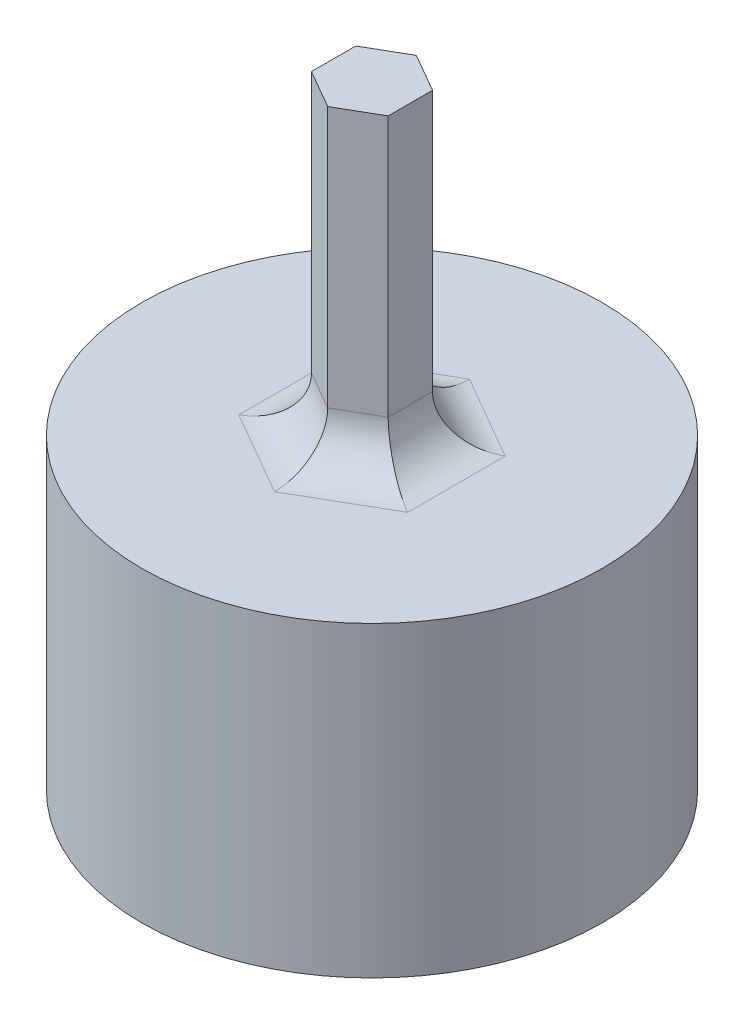
from build123d import *

# Parameters (mm, degrees)
SKETCH1_R           = 15
SKETCH1_W           = 15
SKETCH1_H           = 15
BOSS_EXTRUDE1_DEPTH = 15
SKETCH2_R           = 15
BOSS_EXTRUDE2_DEPTH = 5
BOSS_EXTRUDE3_DEPTH = 20
FILLET1_R           = 3


with BuildPart() as part:
    # Sketch1 → Boss-Extrude1 (new body)
    with BuildSketch(Plane(origin=(0, 0, 0), x_dir=(1, 0, 0), z_dir=(0, 1, 0))):
        with Locations(Location((0, 0, 0), (0, 0, 270))):
            Circle(SKETCH1_R)
        Rectangle(SKETCH1_W, SKETCH1_H, mode=Mode.SUBTRACT)
    extrude(amount=BOSS_EXTRUDE1_DEPTH)

    # Sketch2 → Boss-Extrude2 (add)
    with BuildSketch(Plane(origin=(0, 15, 0), x_dir=(1, 0, 0), z_dir=(0, 1, 0))):
        with Locations(Location((0, 0, 0), (0, 0, 270))):
            Circle(SKETCH2_R)
    extrude(amount=BOSS_EXTRUDE2_DEPTH)

    # Sketch3 → Boss-Extrude3 (add)
    with BuildSketch(Plane(origin=(0, 20, 0), x_dir=(1, 0, 0), z_dir=(0, 1, 0))):
        Polygon((2.5, -1.443375673), (2.5, 1.443375673), (0, 2.886751346), (-2.5, 1.443375673), (-2.5, -1.443375673), (0, -2.886751346), align=None)
    extrude(amount=BOSS_EXTRUDE3_DEPTH)

    # Fillet1
    fillet1_edges = [part.edges().sort_by_distance(p)[0] for p in [
        (2.5, 20, 0),
        (1.25, 20, -2.165063509),
        (-1.25, 20, -2.165063509),
        (-2.5, 20, 0),
        (-1.25, 20, 2.165063509),
        (1.25, 20, 2.165063509),
    ]]
    fillet(fillet1_edges, radius=FILLET1_R)


solid = part.part
